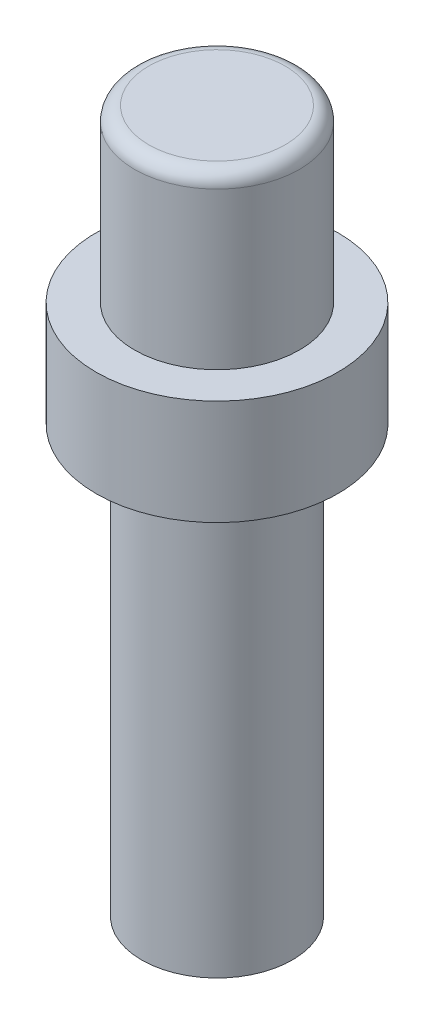
from build123d import *

# Parameters (mm, degrees)
SKETCH1_R           = 2.65
BOSS_EXTRUDE1_DEPTH = 15
SKETCH2_R           = 1.15
CUT_EXTRUDE1_DEPTH  = 12
SKETCH3_R           = 4.25
BOSS_EXTRUDE2_DEPTH = 3.7
SKETCH4_R           = 2.9
BOSS_EXTRUDE3_DEPTH = 6
FILLET2_R           = 0.5


with BuildPart() as part:
    # Sketch1 → Boss-Extrude1 (new body)
    with BuildSketch(Plane(origin=(0, 0, 0), x_dir=(1, 0, 0), z_dir=(0, 1, 0))):
        with Locations(Location((0, 0, 0), (0, 0, 270))):
            Circle(SKETCH1_R)
    extrude(amount=BOSS_EXTRUDE1_DEPTH)

    # Sketch2 → Cut-Extrude1 (cut)
    with BuildSketch(Plane.XZ):
        with Locations(Location((0, 0, 0), (0, 0, 270))):
            Circle(SKETCH2_R)
    extrude(amount=-CUT_EXTRUDE1_DEPTH, mode=Mode.SUBTRACT)

    # Sketch3 → Boss-Extrude2 (add)
    with BuildSketch(Plane(origin=(0, 15, 0), x_dir=(1, 0, 0), z_dir=(0, 1, 0))):
        with Locations(Location((0, 0, 0), (0, 0, 270))):
            Circle(SKETCH3_R)
    extrude(amount=BOSS_EXTRUDE2_DEPTH)

    # Sketch4 → Boss-Extrude3 (add)
    with BuildSketch(Plane(origin=(0, 18.7, 0), x_dir=(1, 0, 0), z_dir=(0, 1, 0))):
        with Locations(Location((0, 0, 0), (0, 0, 270))):
            Circle(SKETCH4_R)
    extrude(amount=BOSS_EXTRUDE3_DEPTH)

    # Fillet2
    fillet2_edges = [part.edges().sort_by_distance(p)[0] for p in [
        (0, 24.7, -2.9),
    ]]
    fillet(fillet2_edges, radius=FILLET2_R)


solid = part.part
